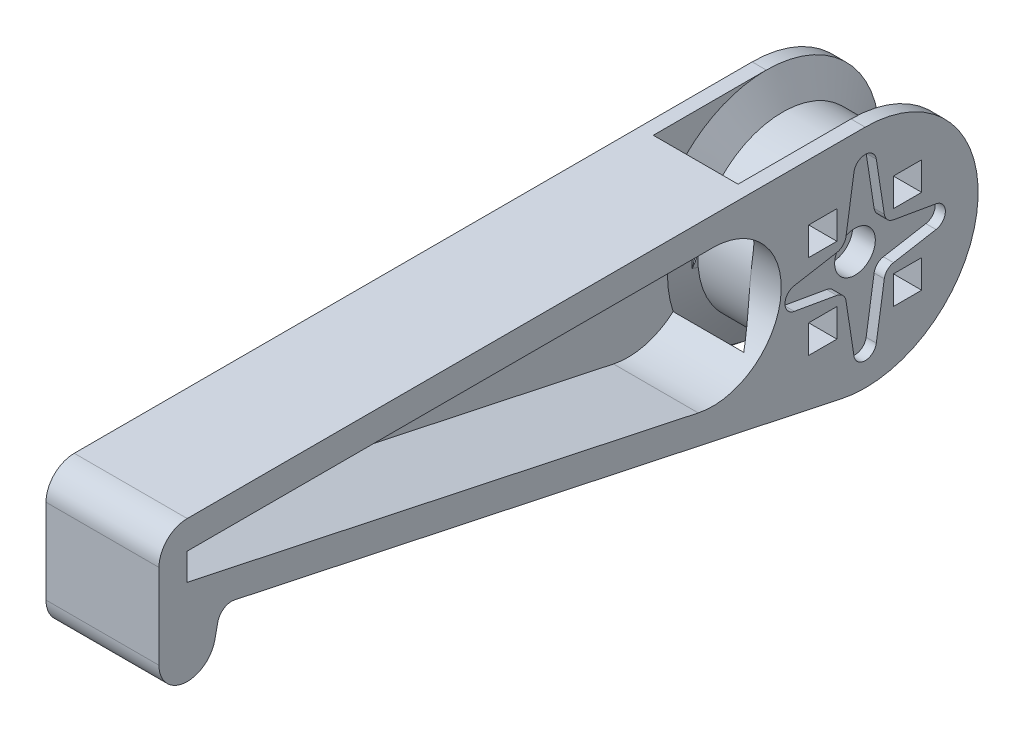
from build123d import *
from build123d.topology import SkipClean

# Parameters (mm, degrees)
BOSS_EXTRUDE1_DEPTH = 25.4
CUT_EXTRUDE2_DEPTH  = 19.05
CUT_EXTRUDE3_DEPTH  = 2.286
SKETCH5_R           = 4.572
CUT_EXTRUDE4_DEPTH  = 5.08
CUT_REVOLVE2_ANGLE  = 45
SKETCH9_W           = 6.35
SKETCH9_H           = 6.35
CUT_EXTRUDE5_DEPTH  = 22.225


with BuildPart() as part:
    # Sketch1 → Boss-Extrude1 (new body)
    with BuildSketch(Plane(origin=(0, 0, 0), x_dir=(0, 0, -1), z_dir=(1, 0, 0))):
        with BuildLine():
            Line((-141.761081999, 4.226292556), (-5.291666667, -24.842670225))
            ThreePointArc((-5.291666667, -24.842670225), (25.260283289, -2.660467656), (0, 25.4))
            Line((0, 25.4), (-152.4, 25.4))
            ThreePointArc((-152.4, 25.4), (-156.890128061, 23.540128061), (-158.75, 19.05))
            Line((-158.75, 19.05), (-158.75, 0))
            ThreePointArc((-158.75, 0), (-153.065116914, -6.315070822), (-146.189332444, -1.322916667))
            Line((-146.189332444, -1.322916667), (-145.527874111, 1.782417111))
            ThreePointArc((-145.527874111, 1.782417111), (-144.150621232, 3.784483023), (-141.761081999, 4.226292556))
        make_face()
    extrude(amount=BOSS_EXTRUDE1_DEPTH)

    # Sketch2 → Cut-Extrude2 (cut)
    with BuildSketch(Plane(origin=(25.4, 0, 0), x_dir=(0, 0, -1), z_dir=(1, 0, 0))):
        with BuildLine():
            Line((-140.438165332, 10.436960112), (-152.4, 12.98491656))
            Line((-152.4, 12.98491656), (-152.4, 19.05))
            Line((-152.4, 19.05), (-34.29795986, 19.05))
            ThreePointArc((-34.29795986, 19.05), (-18.945212467, 1.995350742), (-37.514140007, -11.486594364))
            Line((-37.514140007, -11.486594364), (-140.438165332, 10.436960112))
        make_face()
    extrude(amount=-CUT_EXTRUDE2_DEPTH, mode=Mode.SUBTRACT)

    # Sketch4 → Cut-Extrude3 (cut)
    with BuildSketch(Plane(origin=(25.4, 0, 0), x_dir=(0, 0, -1), z_dir=(1, 0, 0))):
        with BuildLine():
            Line((15.931213115, -2.502088066), (6.373452511, -4.172204454))
            ThreePointArc((6.373452511, -4.172204454), (4.996543737, -4.896495633), (4.300247145, -6.287770782))
            Line((4.300247145, -6.287770782), (2.51041848, -17.912521739))
            ThreePointArc((2.51041848, -17.912521739), (0, -20.066), (-2.51041848, -17.912521739))
            Line((-2.51041848, -17.912521739), (-4.300247145, -6.287770782))
            ThreePointArc((-4.300247145, -6.287770782), (-4.996543737, -4.896495633), (-6.373452511, -4.172204454))
            Line((-6.373452511, -4.172204454), (-15.931213115, -2.502088066))
            ThreePointArc((-15.931213115, -2.502088066), (-18.034, 0), (-15.931213115, 2.502088066))
            Line((-15.931213115, 2.502088066), (-6.373452511, 4.172204454))
            ThreePointArc((-6.373452511, 4.172204454), (-4.996543737, 4.896495633), (-4.300247145, 6.287770782))
            Line((-4.300247145, 6.287770782), (-2.51041848, 17.912521739))
            ThreePointArc((-2.51041848, 17.912521739), (0, 20.066), (2.51041848, 17.912521739))
            Line((2.51041848, 17.912521739), (4.300247145, 6.287770782))
            ThreePointArc((4.300247145, 6.287770782), (4.996543737, 4.896495633), (6.373452511, 4.172204454))
            Line((6.373452511, 4.172204454), (15.931213115, 2.502088066))
            ThreePointArc((15.931213115, 2.502088066), (18.034, 0), (15.931213115, -2.502088066))
        make_face()
    extrude(amount=-CUT_EXTRUDE3_DEPTH, mode=Mode.SUBTRACT)

    # Sketch5 → Cut-Extrude4 (cut)
    with BuildSketch(Plane(origin=(23.114, 0, 0), x_dir=(0, 0, -1), z_dir=(1, 0, 0))):
        Circle(SKETCH5_R)
    extrude(amount=-CUT_EXTRUDE4_DEPTH, mode=Mode.SUBTRACT)

    # Sketch6 → Cut-Revolve1 (revolve, cut)
    with BuildSketch(Plane.XY, mode=Mode.PRIVATE) as cut_revolve1_sk:
        Polygon((22.225, 25.4), (3.175, 25.4), (6.841174209, 19.05), (18.558825791, 19.05), align=None)
    revolve(cut_revolve1_sk.sketch.rotate(Axis((-1000, 0, 0), (1, 0, 0)), 95.058183931), axis=Axis((-1000, 0, 0), (1, 0, 0)), mode=Mode.SUBTRACT)

    # Sketch8 → Cut-Revolve2 (revolve, cut)
    with SkipClean():  # the faces are left unmerged after this step: merging them gives an invalid solid
        with BuildSketch(Plane.XY):
            Polygon((3.175, 25.4), (6.841174209, 19.05), (18.558825791, 19.05), (22.225, 25.4), (22.225, 50.8), (3.175, 50.8), align=None)
        cut_revolve2 = revolve(axis=Axis((-1000, 0, 0), (1, 0, 0)), revolution_arc=CUT_REVOLVE2_ANGLE, mode=Mode.SUBTRACT)

    # Mirror1: Cut-Revolve2 across plane
    with SkipClean():  # the faces are left unmerged after this step: merging them gives an invalid solid
        add(cut_revolve2.mirror(Plane.ZX), mode=Mode.SUBTRACT)

    # Sketch9 → Cut-Extrude5 (cut)
    with SkipClean():  # the faces are left unmerged after this step: merging them gives an invalid solid
        with BuildSketch(Plane(origin=(25.4, 0, 0), x_dir=(0, 0, -1), z_dir=(1, 0, 0))):
            with Locations((9.525, 9.525)):
                Rectangle(SKETCH9_W, SKETCH9_H)
            with Locations((-9.525, 9.525)):
                Rectangle(SKETCH9_W, SKETCH9_H)
            with Locations((9.525, -9.525)):
                Rectangle(SKETCH9_W, SKETCH9_H)
            with Locations((-9.525, -9.525)):
                Rectangle(SKETCH9_W, SKETCH9_H)
        extrude(amount=-CUT_EXTRUDE5_DEPTH, mode=Mode.SUBTRACT)


solid = part.part
